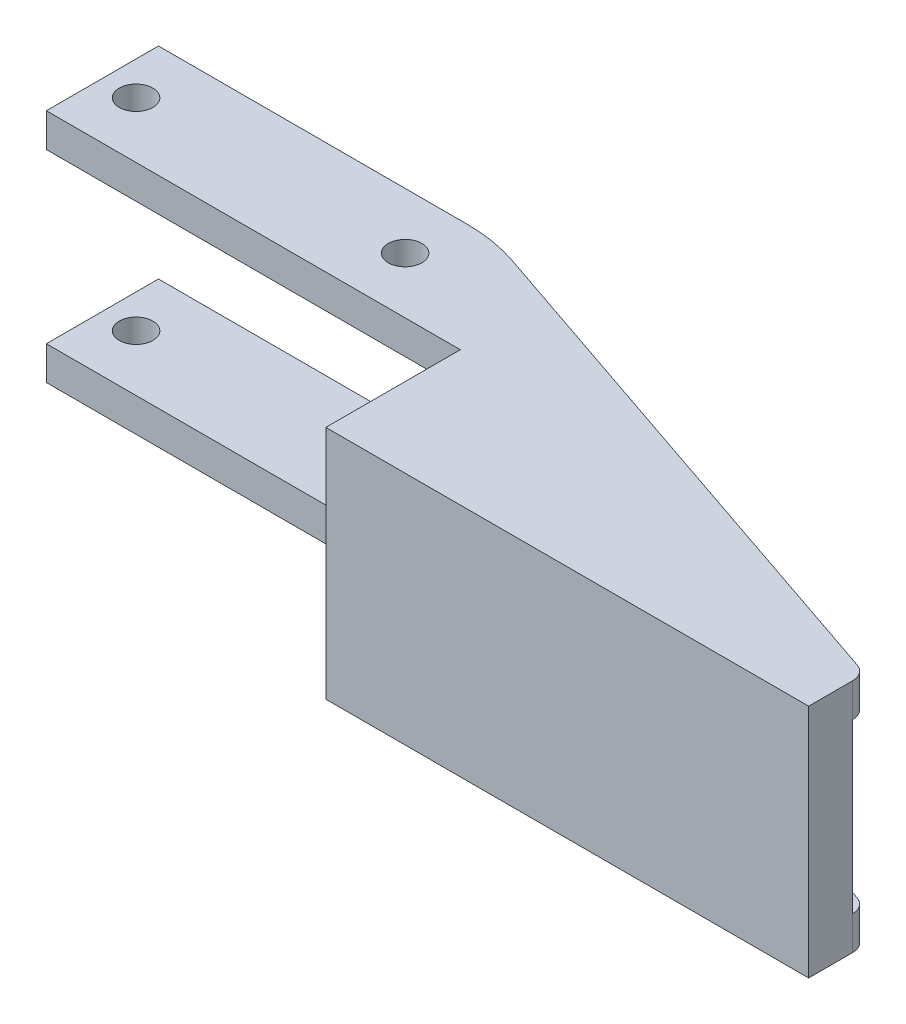
from build123d import *

# Parameters (mm, degrees)
BOSS_EXTRUDE1_DEPTH                      = 3
BOSS_EXTRUDE2_START                      = 15
BOSS_EXTRUDE2_DEPTH                      = 3
SKETCH3_W                                = 1.5
SKETCH3_H                                = 21
F_3_0MM_CLEARANCE_DOWEL_HOLE1_AT_2_COUNT = 2
F_3_0MM_CLEARANCE_DOWEL_HOLE1_AT_2_PITCH = 24
SKETCH5_W                                = 43.073811931
SKETCH5_H                                = 3.925670489
BOSS_EXTRUDE3_DEPTH                      = 15


with BuildPart() as part:
    # Sketch1 → Boss-Extrude1 (new body)
    with BuildSketch(Plane(origin=(0, 0, 0), x_dir=(1, 0, 0), z_dir=(0, 1, 0))):
        with BuildLine():
            Line((-4.577926811, 9.356292891), (42.056666031, -6.499468675))
            ThreePointArc((42.056666031, -6.499468675), (42.793295664, -7.04620955), (43.073811931, -7.919627792))
            Line((43.073811931, -7.919627792), (43.073811931, -11.845298281))
            Line((43.073811931, -11.845298281), (0, -11.845298281))
            Line((0, -11.845298281), (0, 0.154701719))
            Line((0, 0.154701719), (-36.926188069, 0.154701719))
            Line((-36.926188069, 0.154701719), (-36.926188069, 10.154701719))
            Line((-36.926188069, 10.154701719), (-9.406467809, 10.154701719))
            ThreePointArc((-9.406467809, 10.154701719), (-6.959415254, 9.953753506), (-4.577926811, 9.356292891))
        make_face()
    extrude(amount=-BOSS_EXTRUDE1_DEPTH)


with BuildPart() as body_2:
    # Sketch1<2> → Boss-Extrude2 (new body)
    with BuildSketch(Plane(origin=(0, 0, 0), x_dir=(1, 0, 0), z_dir=(0, 1, 0)).offset(BOSS_EXTRUDE2_START)):
        with BuildLine():
            Line((-4.577926811, 9.356292891), (42.056666031, -6.499468675))
            ThreePointArc((42.056666031, -6.499468675), (42.793295664, -7.04620955), (43.073811931, -7.919627792))
            Line((43.073811931, -7.919627792), (43.073811931, -11.845298281))
            Line((43.073811931, -11.845298281), (0, -11.845298281))
            Line((0, -11.845298281), (0, 0.154701719))
            Line((0, 0.154701719), (-36.926188069, 0.154701719))
            Line((-36.926188069, 0.154701719), (-36.926188069, 10.154701719))
            Line((-36.926188069, 10.154701719), (-9.406467809, 10.154701719))
            ThreePointArc((-9.406467809, 10.154701719), (-6.959415254, 9.953753506), (-4.577926811, 9.356292891))
        make_face()
    extrude(amount=BOSS_EXTRUDE2_DEPTH)


with BuildPart() as f_3_0mm_clearance_dowel_hole1_tool:
    # Sketch3 → Ø3.0mm Clearance Dowel Hole1 (revolve)
    with BuildSketch(Plane(origin=(-33.926188069, -3, -5.154701719), x_dir=(0, 0, -1), z_dir=(1, 0, 0))):
        with Locations((0.75, 10.5)):
            Rectangle(SKETCH3_W, SKETCH3_H)
    f_3_0mm_clearance_dowel_hole1 = revolve(axis=Axis((-33.926188069, -9.35, -5.154701719), (0, 1, 0)))


with BuildPart() as part_1:
    add(part.part)

    # Ø3.0mm Clearance Dowel Hole1: cut by f_3_0mm_clearance_dowel_hole1_tool
    add(f_3_0mm_clearance_dowel_hole1_tool.part, mode=Mode.SUBTRACT)


with BuildPart() as body_2_1:
    add(body_2.part)

    # Ø3.0mm Clearance Dowel Hole1: cut by f_3_0mm_clearance_dowel_hole1_tool
    add(f_3_0mm_clearance_dowel_hole1_tool.part, mode=Mode.SUBTRACT)


with BuildPart() as f_3_0mm_clearance_dowel_hole1_at_2_tool:
    # Ø3.0mm Clearance Dowel Hole1 at 2: Ø3.0mm Clearance Dowel Hole1 ×2
    with Locations(*[(i * F_3_0MM_CLEARANCE_DOWEL_HOLE1_AT_2_PITCH, 0, 0) for i in range(1, F_3_0MM_CLEARANCE_DOWEL_HOLE1_AT_2_COUNT)]):
        add(f_3_0mm_clearance_dowel_hole1)


with BuildPart() as part_2:
    add(part_1.part)

    # Ø3.0mm Clearance Dowel Hole1 at 2: cut by f_3_0mm_clearance_dowel_hole1_at_2_tool
    add(f_3_0mm_clearance_dowel_hole1_at_2_tool.part, mode=Mode.SUBTRACT)



with BuildPart() as body_2_2:
    add(body_2_1.part)

    # Ø3.0mm Clearance Dowel Hole1 at 2: cut by f_3_0mm_clearance_dowel_hole1_at_2_tool
    add(f_3_0mm_clearance_dowel_hole1_at_2_tool.part, mode=Mode.SUBTRACT)


with BuildPart() as part_3:
    add(part_2.part)

    add(body_2_2.part)  # Boss-Extrude3 merges body 2
    # Sketch5 → Boss-Extrude3 (add)
    with BuildSketch(Plane(origin=(0, 0, 0), x_dir=(1, 0, 0), z_dir=(0, 1, 0))):
        with Locations((21.536905966, -9.882463037)):
            Rectangle(SKETCH5_W, SKETCH5_H)
    extrude(amount=BOSS_EXTRUDE3_DEPTH)


solid = part_3.part
